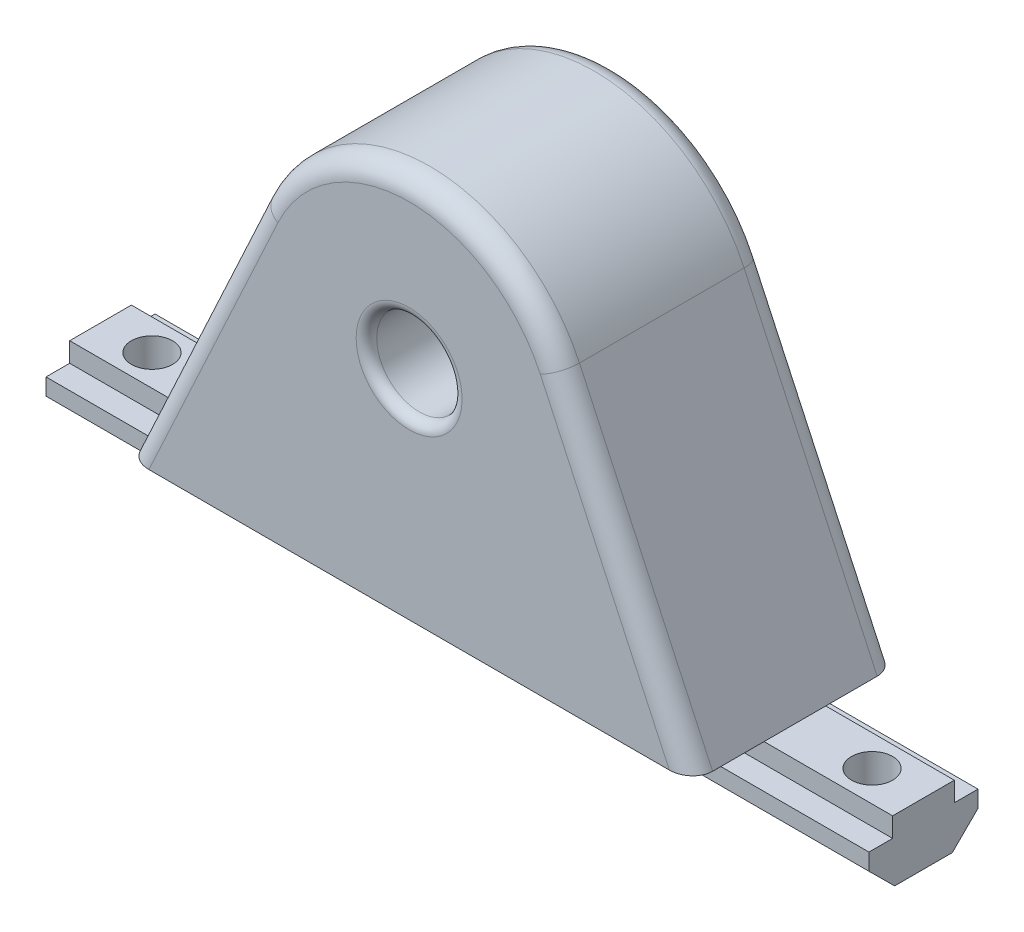
from build123d import *

# Parameters (mm, degrees)
BOSS_EXTRUDE1_DEPTH     = 40
SKETCH2_W               = 55
SKETCH2_H               = 44
BOSS_EXTRUDE2_DEPTH     = 10
CUT_EXTRUDE2_DEPTH      = 65.807406984
CUT_EXTRUDE2_DEPTH_BACK = 65.807406984
SKETCH3_R               = 4.15
CUT_EXTRUDE3_DEPTH      = 65.807406984
CUT_EXTRUDE3_DEPTH_BACK = 65.807406984
SKETCH6_R               = 11.05
CUT_EXTRUDE4_DEPTH      = 60.718003985
FILLET1_R               = 2
FILLET2_R               = 1
SKETCH8_R               = 2
CUT_EXTRUDE5_DEPTH      = 56.532332924


with BuildPart() as part:
    # Sketch1 → Boss-Extrude1 (new, symmetric)
    with BuildSketch(Plane(origin=(0, 0, 0), x_dir=(0, 0, -1), z_dir=(1, 0, 0))):
        Polygon((-3, 6), (3, 6), (3, 4.1), (5.3, 4.1), (5.3, 2.48), (2.8, 0), (-2.8, 0), (-5.3, 2.48), (-5.3, 4.1), (-3, 4.1), align=None)
    extrude(amount=BOSS_EXTRUDE1_DEPTH, both=True)

    # Sketch2 → Boss-Extrude2 (add, symmetric)
    with BuildSketch(Plane.XY):
        with Locations((0, 28)):
            Rectangle(SKETCH2_W, SKETCH2_H)
    extrude(amount=BOSS_EXTRUDE2_DEPTH, both=True)

    # Sketch3 → Cut-Extrude2 (cut, two sides: drawn at the far end of the back side and taken through both)
    with BuildSketch(Plane.XY.offset(-CUT_EXTRUDE2_DEPTH_BACK)):
        with Locations((0, 27.15)):
            Circle(SKETCH3_R)
    extrude(amount=CUT_EXTRUDE2_DEPTH + CUT_EXTRUDE2_DEPTH_BACK, mode=Mode.SUBTRACT)

    # Sketch7 → Cut-Extrude3 (cut, two sides: drawn at the far end of the back side and taken through both)
    with BuildSketch(Plane.XY.offset(-CUT_EXTRUDE3_DEPTH_BACK)):
        with BuildLine():
            Line((27.5, 6), (14.560515369, 33.902324948))
            ThreePointArc((14.560515369, 33.902324948), (0, 43.2), (-14.560515369, 33.902324948))
            Line((-14.560515369, 33.902324948), (-27.5, 6))
            Line((-27.5, 6), (-40, 6))
            Line((-40, 6), (-40, 58.297822633))
            Line((-40, 58.297822633), (40, 58.297822633))
            Line((40, 58.297822633), (40, 6))
            Line((40, 6), (27.5, 6))
        make_face()
    extrude(amount=CUT_EXTRUDE3_DEPTH + CUT_EXTRUDE3_DEPTH_BACK, mode=Mode.SUBTRACT)

    # Sketch6 → Cut-Extrude4 (cut, through all)
    with BuildSketch(Plane.XY):
        with Locations((0, 27.15)):
            Circle(SKETCH6_R)
    extrude(amount=-CUT_EXTRUDE4_DEPTH, mode=Mode.SUBTRACT)

    # Fillet1
    fillet1_edges = [part.edges().sort_by_distance(p)[0] for p in [
        (21.030257684, 19.951162474, 10),
        (-21.030257684, 19.951162474, 10),
        (0, 43.2, 10),
        (21.030257684, 19.951162474, -10),
        (0, 43.2, -10),
        (-21.030257684, 19.951162474, -10),
    ]]
    fillet(fillet1_edges, radius=FILLET1_R)

    # Fillet2
    fillet2_edges = [part.edges().sort_by_distance(p)[0] for p in [
        (-4.15, 27.15, 10),
        (-4.15, 27.15, 0),
    ]]
    fillet(fillet2_edges, radius=FILLET2_R)

    # Sketch8 → Cut-Extrude5 (cut, through all)
    with BuildSketch(Plane(origin=(0, 6, 0), x_dir=(1, 0, 0), z_dir=(0, 1, 0))):
        with Locations(Location((35, 0, 0), (0, 0, 270))):
            Circle(SKETCH8_R)
        with Locations(Location((-35, 0, 0), (0, 0, 270))):
            Circle(SKETCH8_R)
    extrude(amount=-CUT_EXTRUDE5_DEPTH, mode=Mode.SUBTRACT)


solid = part.part
